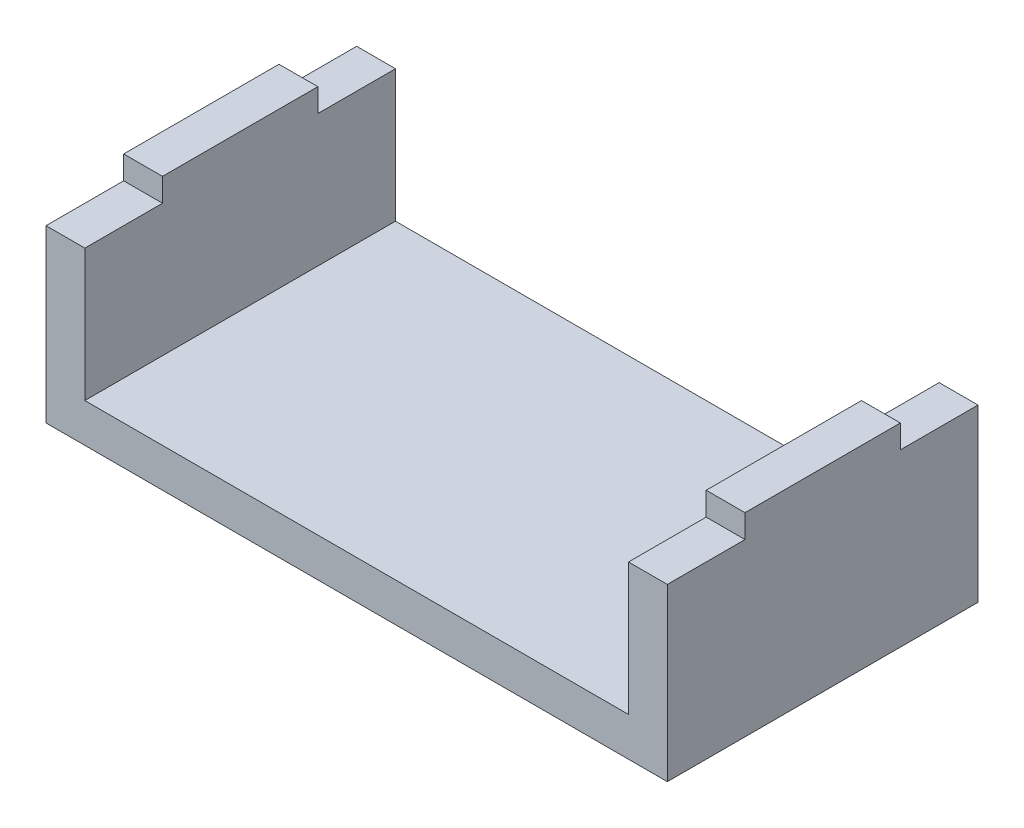
from build123d import *

# Parameters (mm, degrees)
SKETCH1_W                = 80
SKETCH1_H                = 40
BOSS_EXTRUDE1_DEPTH      = 5
SKETCH2_W                = 5
SKETCH2_H                = 40
BOSS_EXTRUDE2_DEPTH      = 20
SKETCH3_W                = 5
SKETCH3_H                = 40
BOSS_EXTRUDE3_DEPTH      = 20
SKETCH4_W                = 5
SKETCH4_H                = 10
CUT_EXTRUDE1_DEPTH       = 3
SKETCH5_W                = 5
SKETCH5_H                = 10
CUT_EXTRUDE2_DEPTH       = 3
M3_CLEARANCE_HOLE1_D     = 3.4
M3_CLEARANCE_HOLE1_DEPTH = 5
M3_CLEARANCE_HOLE1_TIP   = 1.021463052


with BuildPart() as part:
    # Sketch1 → Boss-Extrude1 (new body)
    with BuildSketch(Plane(origin=(0, 0, 0), x_dir=(1, 0, 0), z_dir=(0, 1, 0))):
        Rectangle(SKETCH1_W, SKETCH1_H)
    extrude(amount=BOSS_EXTRUDE1_DEPTH)

    # Sketch2 → Boss-Extrude2 (add)
    with BuildSketch(Plane(origin=(0, 5, 0), x_dir=(1, 0, 0), z_dir=(0, 1, 0))):
        with Locations((-37.5, 0)):
            Rectangle(SKETCH2_W, SKETCH2_H)
    extrude(amount=BOSS_EXTRUDE2_DEPTH)

    # Sketch3 → Boss-Extrude3 (add)
    with BuildSketch(Plane(origin=(0, 5, 0), x_dir=(1, 0, 0), z_dir=(0, 1, 0))):
        with Locations((37.5, 0)):
            Rectangle(SKETCH3_W, SKETCH3_H)
    extrude(amount=BOSS_EXTRUDE3_DEPTH)

    # Sketch4 → Cut-Extrude1 (cut)
    with BuildSketch(Plane(origin=(0, 25, 0), x_dir=(1, 0, 0), z_dir=(0, 1, 0))):
        with Locations((-37.5, 15)):
            Rectangle(SKETCH4_W, SKETCH4_H)
        with Locations((-37.5, -15)):
            Rectangle(SKETCH4_W, SKETCH4_H)
    extrude(amount=-CUT_EXTRUDE1_DEPTH, mode=Mode.SUBTRACT)

    # Sketch5 → Cut-Extrude2 (cut)
    with BuildSketch(Plane(origin=(0, 25, 0), x_dir=(1, 0, 0), z_dir=(0, 1, 0))):
        with Locations((37.5, -15)):
            Rectangle(SKETCH5_W, SKETCH5_H)
        with Locations((37.5, 15)):
            Rectangle(SKETCH5_W, SKETCH5_H)
    extrude(amount=-CUT_EXTRUDE2_DEPTH, mode=Mode.SUBTRACT)

    # M3 Clearance Hole1
    with Locations(Plane(origin=(0, 0, 0), x_dir=(-1, 0, 0), z_dir=(0, -1, 0))):
        with Locations((37.5, -17.5), (37.5, 17.5), (-37.5, 17.5), (-37.5, -17.5)):
            Hole(M3_CLEARANCE_HOLE1_D / 2, depth=M3_CLEARANCE_HOLE1_DEPTH)
            with Locations((0, 0, -(M3_CLEARANCE_HOLE1_DEPTH + M3_CLEARANCE_HOLE1_TIP / 2))):  # 118° drill point
                Cone(0, M3_CLEARANCE_HOLE1_D / 2, M3_CLEARANCE_HOLE1_TIP, mode=Mode.SUBTRACT)


solid = part.part
